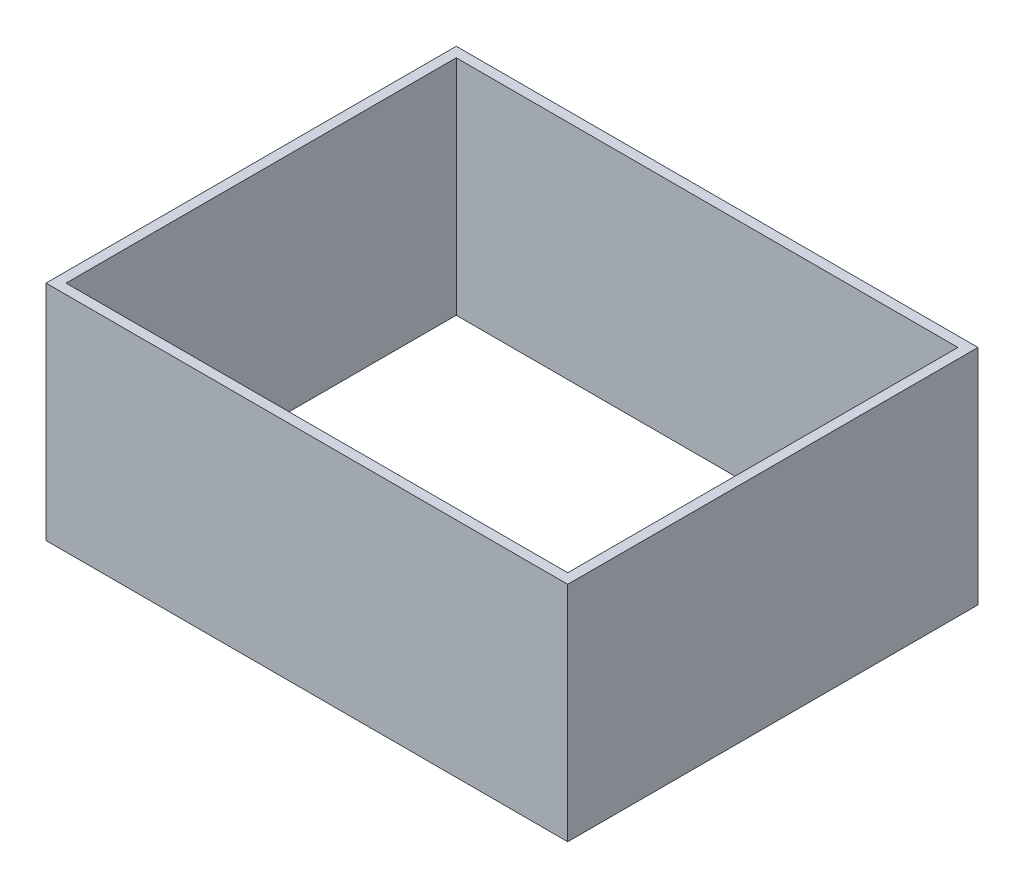
from build123d import *

# Parameters (mm, degrees)
SKETCH_1_W      = 936
SKETCH_1_H      = 736
SKETCH_1_W_2    = 900
SKETCH_1_H_2    = 700
EXTRUDE_1_DEPTH = 400


with BuildPart() as part:
    # 草图1 → 凸台-拉伸1 (new body)
    with BuildSketch(Plane(origin=(0, 0, 0), x_dir=(1, 0, 0), z_dir=(0, 1, 0))):
        with Locations((473.076923077, -350)):
            Rectangle(SKETCH_1_W, SKETCH_1_H)
        with Locations((473.076923077, -350)):
            Rectangle(SKETCH_1_W_2, SKETCH_1_H_2, mode=Mode.SUBTRACT)
    extrude(amount=EXTRUDE_1_DEPTH)


solid = part.part
